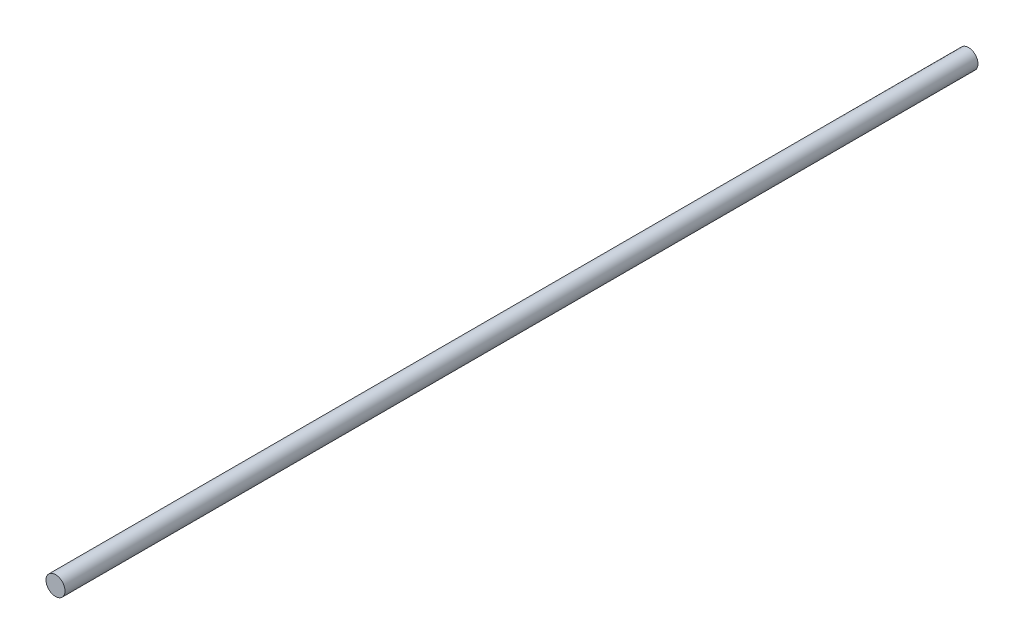
from build123d import *

# Parameters (mm, degrees)
SKETCH_1_R      = 4
EXTRUDE_1_DEPTH = 384


with BuildPart() as part:
    # 草图1 → 凸台-拉伸1 (new body)
    with BuildSketch(Plane.XY):
        Circle(SKETCH_1_R)
    extrude(amount=EXTRUDE_1_DEPTH)


solid = part.part
